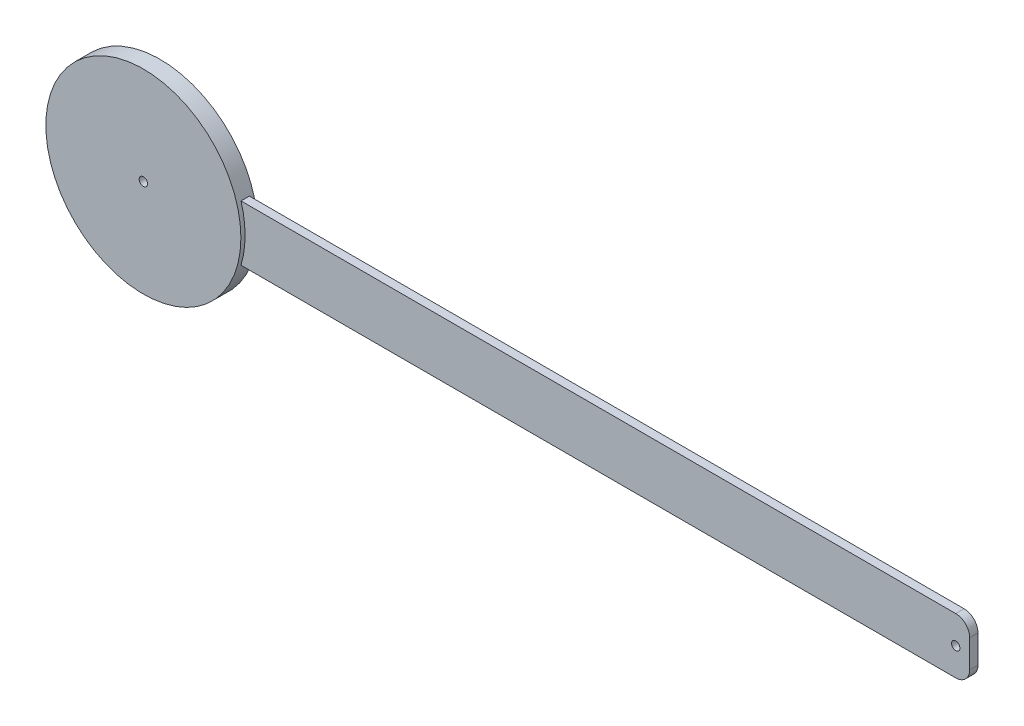
from build123d import *

# Parameters (mm, degrees)
SKETCH1_R                = 1.5
BOSS_EXTRUDE1_DEPTH      = 3
BOSS_EXTRUDE2_DEPTH      = 3
BOSS_EXTRUDE2_DEPTH_BACK = 3
BOSS_EXTRUDE2_START      = 1.5
SKETCH4_R                = 35
SKETCH9_R                = 1.5
CUT_EXTRUDE1_DEPTH       = 184.469343488


with BuildPart() as part:
    # Sketch1 → Boss-Extrude1 (new body)
    with BuildSketch(Plane.XY):
        with BuildLine():
            Line((-145, 10), (145, 10))
            ThreePointArc((145, 10), (148.535533906, 8.535533906), (150, 5))
            Line((150, 5), (150, -5))
            ThreePointArc((150, -5), (148.535533906, -8.535533906), (145, -10))
            Line((145, -10), (-145, -10))
            ThreePointArc((-145, -10), (-148.535533906, -8.535533906), (-150, -5))
            Line((-150, -5), (-150, 5))
            ThreePointArc((-150, 5), (-148.535533906, 8.535533906), (-145, 10))
        make_face()
        with Locations((145, 0)):
            Circle(SKETCH1_R, mode=Mode.SUBTRACT)
    extrude(amount=BOSS_EXTRUDE1_DEPTH)

    # Sketch4 → Boss-Extrude2 (add, two sides: drawn at the far end of the back side and taken through both)
    with BuildSketch(Plane.XY.offset(BOSS_EXTRUDE2_START - BOSS_EXTRUDE2_DEPTH_BACK)):
        with Locations((-145, 0)):
            Circle(SKETCH4_R)
    extrude(amount=BOSS_EXTRUDE2_DEPTH + BOSS_EXTRUDE2_DEPTH_BACK)

    # Sketch9 → Cut-Extrude1 (cut, through all)
    with BuildSketch(Plane.XY.offset(4.5)):
        with Locations((-145, 0)):
            Circle(SKETCH9_R)
    extrude(amount=-CUT_EXTRUDE1_DEPTH, mode=Mode.SUBTRACT)


solid = part.part
